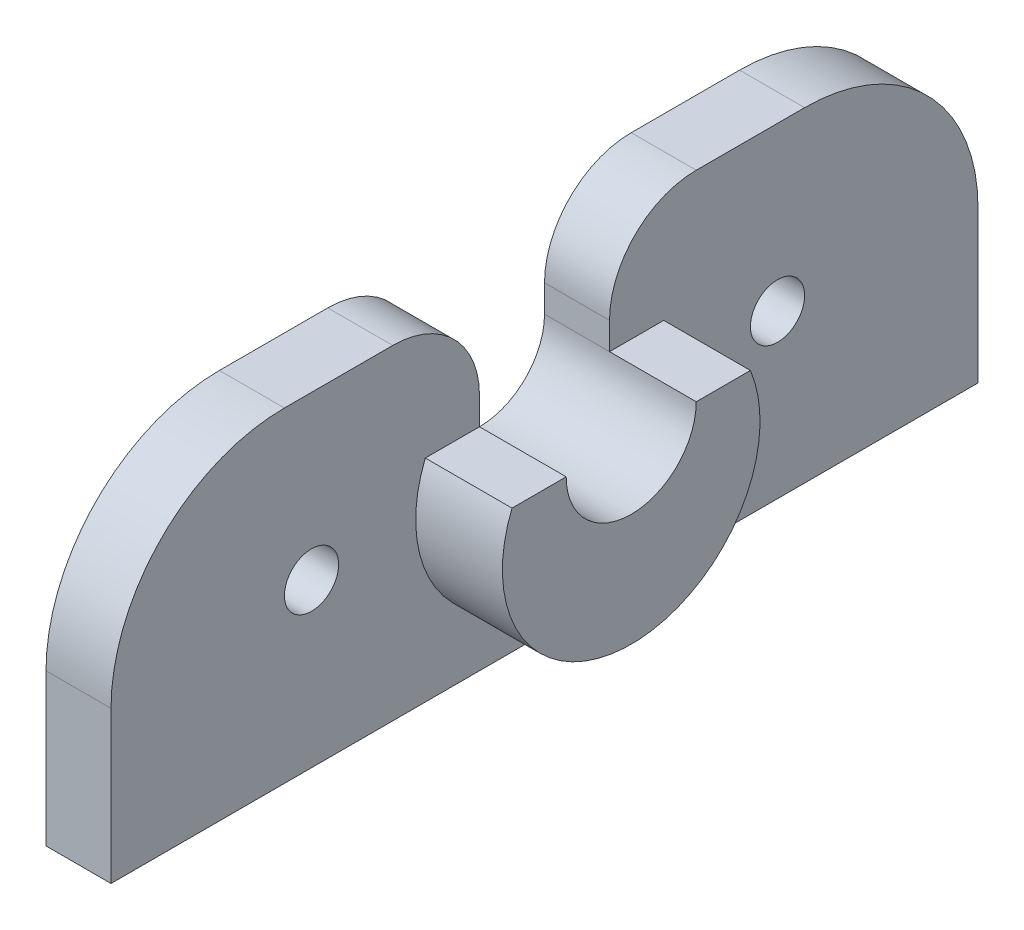
from build123d import *

# Parameters (mm, degrees)
SKETCH1_W           = 40
SKETCH1_H           = 15
BOSS_EXTRUDE1_DEPTH = 3
SKETCH2_R           = 1.25
CUT_EXTRUDE1_DEPTH  = 5
FILLET1_R           = 8
BOSS_EXTRUDE2_START = 4
BOSS_EXTRUDE2_DEPTH = 4
FILLET2_R           = 4


with BuildPart() as part:
    # Sketch1 → Boss-Extrude1 (new body)
    with BuildSketch(Plane(origin=(0, 0, 0), x_dir=(0, 0, -1), z_dir=(1, 0, 0))):
        Rectangle(SKETCH1_W, SKETCH1_H)
    extrude(amount=BOSS_EXTRUDE1_DEPTH)

    # Sketch2 → Cut-Extrude1 (cut)
    with BuildSketch(Plane(origin=(3, 0, 0), x_dir=(0, 0, -1), z_dir=(1, 0, 0))):
        with Locations((-10.75, 0)):
            Circle(SKETCH2_R)
        with BuildLine():
            Line((-3, 2.25), (-3, 7.5))
            Line((-3, 7.5), (3, 7.5))
            Line((3, 7.5), (3, 2.25))
            ThreePointArc((3, 2.25), (0, -0.75), (-3, 2.25))
        make_face()
    cut_extrude1 = extrude(amount=-CUT_EXTRUDE1_DEPTH, mode=Mode.SUBTRACT)

    # Mirror1: Cut-Extrude1 across plane
    add(cut_extrude1.mirror(Plane.XY), mode=Mode.SUBTRACT)

    # Fillet1
    fillet1_edges = [part.edges().sort_by_distance(p)[0] for p in [
        (1.5, 7.5, 20),
        (1.5, 7.5, -20),
    ]]
    fillet(fillet1_edges, radius=FILLET1_R)

    # Sketch3 → Boss-Extrude2 (add)
    with BuildSketch(Plane(origin=(3, 0, 0), x_dir=(0, 0, -1), z_dir=(1, 0, 0)).offset(BOSS_EXTRUDE2_START)):
        with BuildLine():
            Line((-3, 2.25), (-5.5, 2.25))
            ThreePointArc((-5.5, 2.25), (0, -5.942432162), (5.5, 2.25))
            Line((5.5, 2.25), (3, 2.25))
            ThreePointArc((3, 2.25), (0, -0.75), (-3, 2.25))
        make_face()
    extrude(amount=-BOSS_EXTRUDE2_DEPTH)

    # Fillet2
    fillet2_edges = [part.edges().sort_by_distance(p)[0] for p in [
        (1.5, 7.5, 3),
        (1.5, 7.5, -3),
    ]]
    fillet(fillet2_edges, radius=FILLET2_R)


solid = part.part
